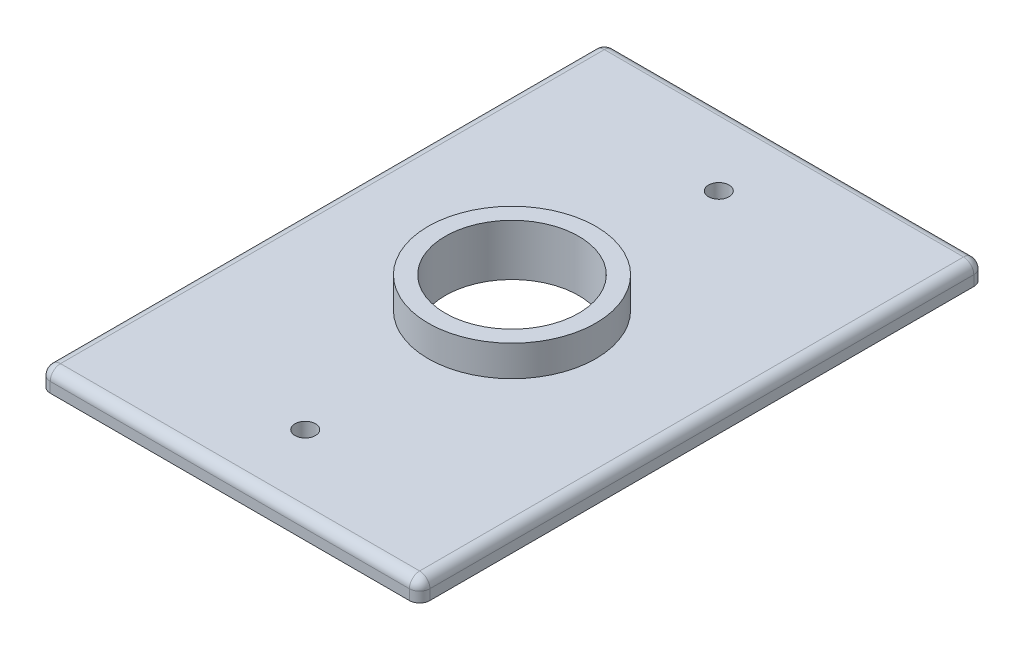
from build123d import *

# Parameters (mm, degrees)
ESBO_O1_W                  = 74
ESBO_O1_H                  = 110
RESSALTO_EXTRUS_O1_DEPTH   = 4
FILETE1_R                  = 2
FILETE2_R                  = 2
FILETE3_R                  = 2
FILETE4_R                  = 2
CORTE_EXTRUS_O1_DEPTH      = 15
CORTE_EXTRUS_O1_DEPTH_BACK = 10
ESBO_O2_R                  = 13
CORTE_EXTRUS_O3_DEPTH      = 15
CORTE_EXTRUS_O3_DEPTH_BACK = 15
ESBO_O3_R                  = 2
ESBO_O4_R                  = 16.343681483
ESBO_O4_R_2                = 13
RESSALTO_EXTRUS_O2_DEPTH   = 10


with BuildPart() as part:
    # Esboço1 → Ressalto-extrusão1 (new body)
    with BuildSketch(Plane(origin=(0, 0, 0), x_dir=(1, 0, 0), z_dir=(0, 1, 0))):
        with Locations((27.707512014, -44.028932547)):
            Rectangle(ESBO_O1_W, ESBO_O1_H)
    extrude(amount=RESSALTO_EXTRUS_O1_DEPTH)

    # Filete1
    filete1_edges = [part.edges().sort_by_distance(p)[0] for p in [
        (27.707512014, 4, 99.028932547),
    ]]
    fillet(filete1_edges, radius=FILETE1_R)

    # Filete2
    filete2_edges = [part.edges().sort_by_distance(p)[0] for p in [
        (64.707512014, 4, 43.028932547),
        (64.707512014, 1, 99.028932547),
        (64.707512014, 3.414213562, 98.443146109),
    ]]
    fillet(filete2_edges, radius=FILETE2_R)

    # Filete3
    filete3_edges = [part.edges().sort_by_distance(p)[0] for p in [
        (64.707512014, 1, -10.971067453),
        (26.707512014, 4, -10.971067453),
        (64.121725576, 3.414213562, -10.971067453),
    ]]
    fillet(filete3_edges, radius=FILETE3_R)

    # Filete4
    filete4_edges = [part.edges().sort_by_distance(p)[0] for p in [
        (-9.292487986, 1, 99.028932547),
        (-9.292487986, 3.414213562, 98.443146109),
        (-9.292487986, 1, -10.971067453),
        (-9.292487986, 4, 44.028932547),
        (-9.292487986, 3.414213562, -10.385281015),
    ]]
    fillet(filete4_edges, radius=FILETE4_R)

    # Esboço2 → Corte-extrusão1 (cut, two sides: drawn at the far end of the back side and taken through both)
    with BuildSketch(Plane(origin=(0, 0, 0), x_dir=(1, 0, 0), z_dir=(0, 1, 0)).offset(-CORTE_EXTRUS_O1_DEPTH_BACK)):
        with Locations(Location((27.707512014, -44.028932547, 0), (0, 0, 270))):
            Circle(ESBO_O2_R)
    extrude(amount=CORTE_EXTRUS_O1_DEPTH + CORTE_EXTRUS_O1_DEPTH_BACK, mode=Mode.SUBTRACT)

    # Esboço3 → Corte-extrusão3 (cut, two sides: drawn at the far end of the back side and taken through both)
    with BuildSketch(Plane(origin=(0, 0, 0), x_dir=(1, 0, 0), z_dir=(0, 1, 0)).offset(-CORTE_EXTRUS_O3_DEPTH_BACK)):
        with Locations(Location((27.707512014, -84.328932547, 0), (0, 0, 270))):
            Circle(ESBO_O3_R)
        with Locations(Location((27.707512014, -3.728932547, 0), (0, 0, 270))):
            Circle(ESBO_O3_R)
    extrude(amount=CORTE_EXTRUS_O3_DEPTH + CORTE_EXTRUS_O3_DEPTH_BACK, mode=Mode.SUBTRACT)

    # Esboço4 → Ressalto-extrusão2 (add)
    with BuildSketch(Plane(origin=(0, 0, 0), x_dir=(1, 0, 0), z_dir=(0, 1, 0))):
        with Locations(Location((27.707512014, -44.028932547, 0), (0, 0, 270))):
            Circle(ESBO_O4_R)
        with Locations(Location((27.707512014, -44.028932547, 0), (0, 0, 270))):
            Circle(ESBO_O4_R_2, mode=Mode.SUBTRACT)
    extrude(amount=RESSALTO_EXTRUS_O2_DEPTH)


solid = part.part
